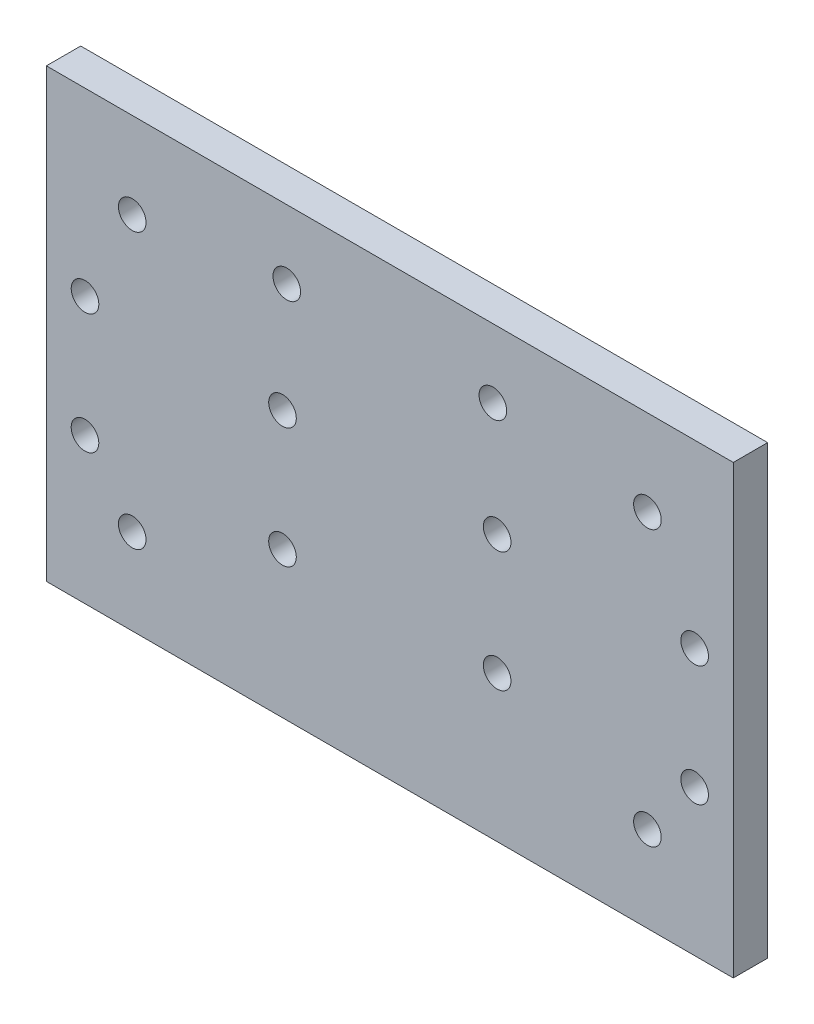
from build123d import *

# Parameters (mm, degrees)
SKETCH1_W                     = 127
SKETCH1_H                     = 82.55
PLATE_DEPTH                   = 6.35
BEARING_NUT_HELICOIL_HOLES_D  = 5.1054
ROUTER_MOUNT_HELICOIL_HOLES_D = 5.1054


with BuildPart() as part:
    # Sketch1 → Plate (new body)
    with BuildSketch(Plane.XY):
        Rectangle(SKETCH1_W, SKETCH1_H)
    extrude(amount=PLATE_DEPTH)

    # Bearing/Nut Helicoil Holes (through all)
    with Locations(Plane(origin=(0, 0, 0), x_dir=(-1, 0, 0), z_dir=(0, 0, -1))):
        with Locations((-56.3565, 7.9375), (-19.844, -14.2875), (-56.3565, -14.2875), (-19.844, 7.9375), (19.844, 7.9375), (56.3565, -14.2875), (19.844, -14.2875), (56.3565, 7.9375), (-19.05, 28.575), (19.05, 28.575)):
            Hole(BEARING_NUT_HELICOIL_HOLES_D / 2)

    # Router Mount Helicoil Holes (through all)
    with Locations(Plane(origin=(0, 0, 0), x_dir=(-1, 0, 0), z_dir=(0, 0, -1))):
        with Locations((-47.625, 25.4), (47.625, -25.4), (-47.625, -25.4), (47.625, 25.4)):
            Hole(ROUTER_MOUNT_HELICOIL_HOLES_D / 2)


solid = part.part
